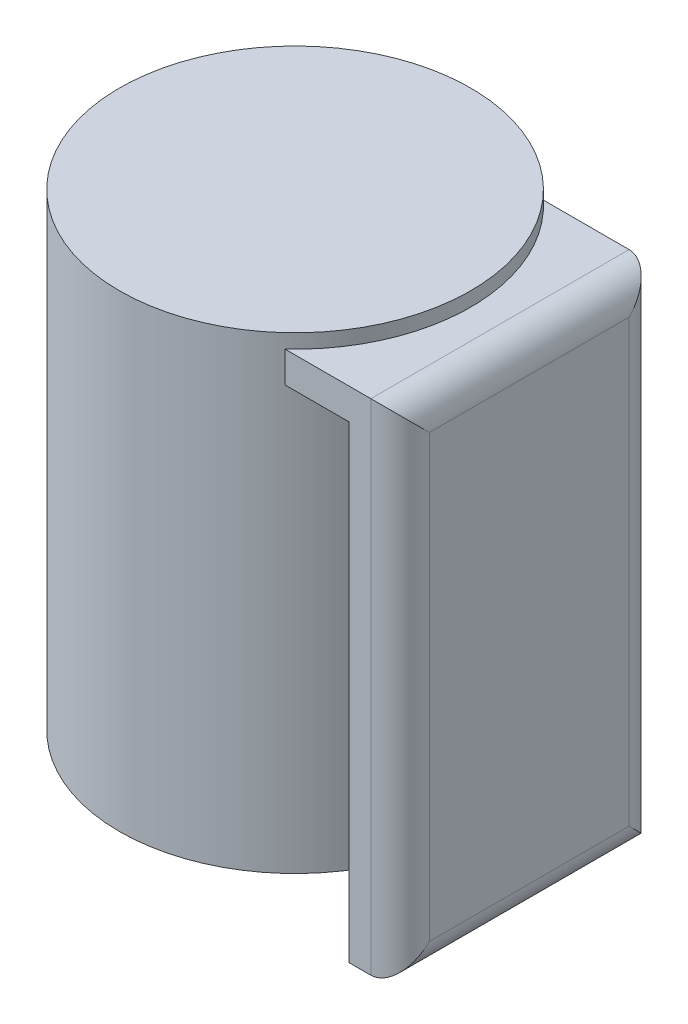
from build123d import *

# Parameters (mm, degrees)
SKETCH2_R           = 15
SKETCH2_R_2         = 12.5
BOSS_EXTRUDE1_DEPTH = 35
SKETCH3_R           = 15
BOSS_EXTRUDE2_DEPTH = 5
SKETCH4_W           = 22.056214186
SKETCH4_H           = 2.649940184
BOSS_EXTRUDE3_DEPTH = 10
SKETCH5_W           = 4.385639536
SKETCH5_H           = 22.056214186
BOSS_EXTRUDE4_DEPTH = 40
FILLET1_R           = 2.5


with BuildPart() as part:
    # Sketch2 → Boss-Extrude1 (new body)
    with BuildSketch(Plane(origin=(0, 0, 0), x_dir=(1, 0, 0), z_dir=(0, 1, 0))):
        with Locations(Location((0, 0, 0), (0, 0, 270))):
            Circle(SKETCH2_R)
        with Locations(Location((0, 0, 0), (0, 0, 270))):
            Circle(SKETCH2_R_2, mode=Mode.SUBTRACT)
    extrude(amount=BOSS_EXTRUDE1_DEPTH)

    # Sketch3 → Boss-Extrude2 (add)
    with BuildSketch(Plane(origin=(0, 35, 0), x_dir=(1, 0, 0), z_dir=(0, 1, 0))):
        with Locations(Location((0, 0, 0), (0, 0, 270))):
            Circle(SKETCH3_R)
    extrude(amount=BOSS_EXTRUDE2_DEPTH)

    # Sketch4 → Boss-Extrude3 (add)
    with BuildSketch(Plane(origin=(10, 0, 0), x_dir=(0, 0, -1), z_dir=(1, 0, 0))):
        with Locations((0, 37.460010141)):
            Rectangle(SKETCH4_W, SKETCH4_H)
    extrude(amount=BOSS_EXTRUDE3_DEPTH)

    # Sketch5 → Boss-Extrude4 (add)
    with BuildSketch(Plane.XZ.offset(-36.135040049)):
        with Locations((17.807180232, 0)):
            Rectangle(SKETCH5_W, SKETCH5_H)
    extrude(amount=BOSS_EXTRUDE4_DEPTH)

    # Fillet1
    fillet1_edges = [part.edges().sort_by_distance(p)[0] for p in [
        (20, 17.460010141, -11.028107093),
        (20, 38.784980233, 0),
        (20, 17.460010141, 11.028107093),
        (20, -3.864959951, 0),
    ]]
    fillet(fillet1_edges, radius=FILLET1_R)


solid = part.part
